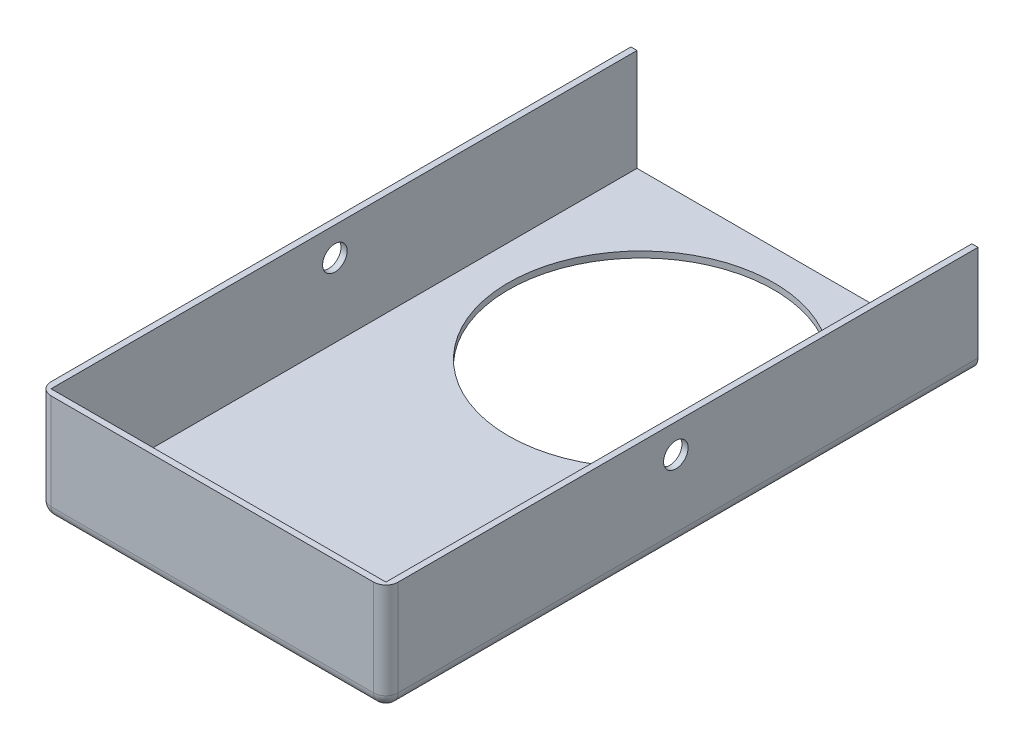
from build123d import *

# Parameters (mm, degrees)
SKETCH1_W               = 85
SKETCH1_H               = 145
SKETCH1_R               = 32.5
SKETCH1_R_2             = 3
BOSS_EXTRUDE1_DEPTH     = 1.5
SKETCH2_W               = 82
SKETCH2_H               = 1.5
BOSS_EXTRUDE2_DEPTH     = 25
CUT_EXTRUDE1_DEPTH      = 89.117818856
CUT_EXTRUDE1_DEPTH_BACK = 89.117818856
SKETCH3_R               = 3
FILLET1_R               = 3
SKETCH4_R               = 3.5
SKETCH4_R_2             = 3
BOSS_EXTRUDE3_DEPTH     = 3
FILLET2_R               = 1


with BuildPart() as part:
    # Sketch1 → Boss-Extrude1 (new body)
    with BuildSketch(Plane(origin=(0, 0, 0), x_dir=(1, 0, 0), z_dir=(0, 1, 0))):
        Rectangle(SKETCH1_W, SKETCH1_H)
        with Locations(Location((0, 32.5, 0), (0, 0, 270))):
            Circle(SKETCH1_R, mode=Mode.SUBTRACT)
        with Locations(Location((0, -54.5, 0), (0, 0, 270))):
            Circle(SKETCH1_R_2, mode=Mode.SUBTRACT)
    extrude(amount=BOSS_EXTRUDE1_DEPTH)

    # Sketch2 → Boss-Extrude2 (add)
    with BuildSketch(Plane(origin=(0, 1.5, 0), x_dir=(1, 0, 0), z_dir=(0, 1, 0))):
        Polygon((-42.5, 72.5), (-42.5, -72.5), (-41, -72.5), (-41, -71), (-41, 72.5), align=None)
        with Locations((0, -71.75)):
            Rectangle(SKETCH2_W, SKETCH2_H)
        Polygon((41, -71), (41, -72.5), (42.5, -72.5), (42.5, 72.5), (41, 72.5), align=None)
    extrude(amount=BOSS_EXTRUDE2_DEPTH)

    # Sketch3 → Cut-Extrude1 (cut, two sides: drawn at the far end of the back side and taken through both)
    with BuildSketch(Plane(origin=(0, 0, 0), x_dir=(0, 0, -1), z_dir=(1, 0, 0)).offset(-CUT_EXTRUDE1_DEPTH_BACK)):
        with Locations((-1.5, 19.5)):
            Circle(SKETCH3_R)
    extrude(amount=CUT_EXTRUDE1_DEPTH + CUT_EXTRUDE1_DEPTH_BACK, mode=Mode.SUBTRACT)

    # Fillet1
    fillet1_edges = [part.edges().sort_by_distance(p)[0] for p in [
        (42.5, 0, 0),
        (0, 0, 72.5),
        (-42.5, 0, 0),
        (42.5, 13.25, 72.5),
        (-42.5, 13.25, 72.5),
    ]]
    fillet(fillet1_edges, radius=FILLET1_R)

    # Sketch4 → Boss-Extrude3 (add)
    with BuildSketch(Plane(origin=(0, 1.5, 0), x_dir=(1, 0, 0), z_dir=(0, 1, 0))):
        with Locations(Location((0, -54.5, 0), (0, 0, 270))):
            Circle(SKETCH4_R)
        with Locations(Location((0, -54.5, 0), (0, 0, 270))):
            Circle(SKETCH4_R_2, mode=Mode.SUBTRACT)
    extrude(amount=BOSS_EXTRUDE3_DEPTH)

    # Fillet2
    fillet2_edges = [part.edges().sort_by_distance(p)[0] for p in [
        (0, 1.5, 51),
    ]]
    fillet(fillet2_edges, radius=FILLET2_R)


solid = part.part
